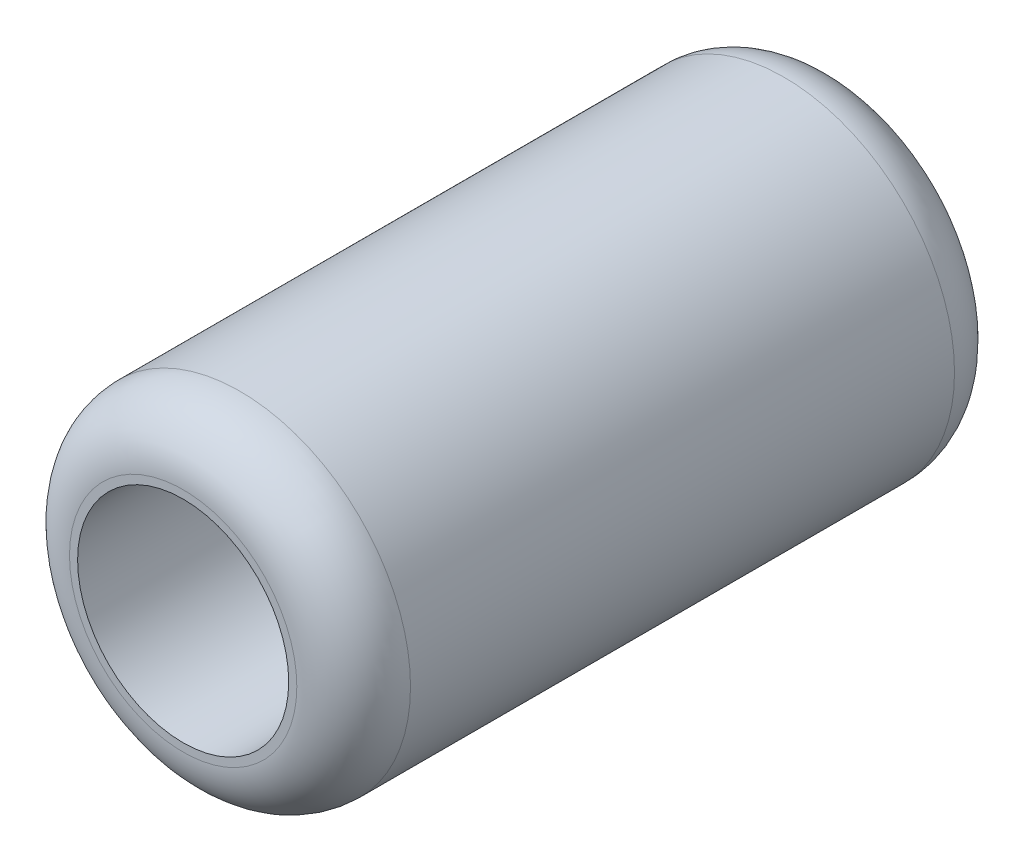
from build123d import *

# Parameters (mm, degrees)
SKETCH1_R           = 10.5
BOSS_EXTRUDE1_DEPTH = 40.5
SHELL1_T            = -4
FILLET1_R           = 3.5
FILLET2_R           = 3.5
FILLET3_R           = 1


with BuildPart() as part:
    # Sketch1 → Boss-Extrude1 (new body)
    with BuildSketch(Plane.XY):
        Circle(SKETCH1_R)
    extrude(amount=BOSS_EXTRUDE1_DEPTH)

    # Shell1
    shell1_openings = [part.faces().sort_by_distance(p)[0] for p in [
        (0, 0, 40.5),
    ]]
    offset(amount=SHELL1_T, openings=shell1_openings, kind=Kind.INTERSECTION)

    # Fillet1
    fillet1_edges = [part.edges().sort_by_distance(p)[0] for p in [
        (-10.5, 0, 40.5),
    ]]
    fillet(fillet1_edges, radius=FILLET1_R)

    # Fillet2
    fillet2_edges = [part.edges().sort_by_distance(p)[0] for p in [
        (-10.5, 0, 0),
    ]]
    fillet(fillet2_edges, radius=FILLET2_R)

    # Fillet3
    fillet3_edges = [part.edges().sort_by_distance(p)[0] for p in [
        (-6.5, 0, 4),
    ]]
    fillet(fillet3_edges, radius=FILLET3_R)


solid = part.part
